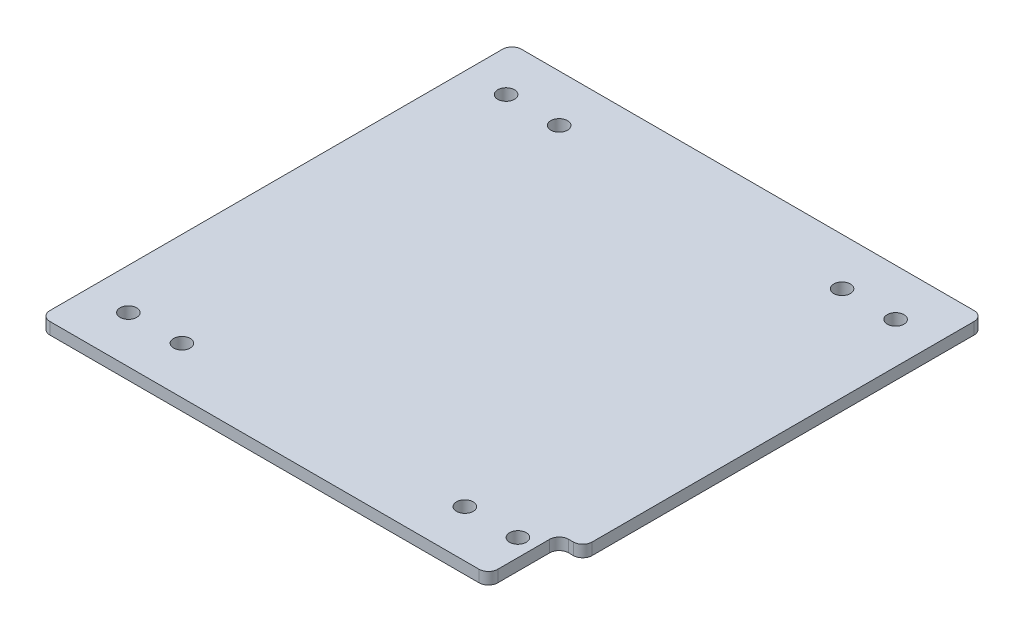
from build123d import *

# Parameters (mm, degrees)
SKETCH1_W                   = 127
SKETCH1_H                   = 127
BOSS_EXTRUDE1_DEPTH         = 3.175
F_16_0_177_DIAMETER_HOLE1_D = 4.4958
F_16_0_177_DIAMETER_HOLE2_D = 4.4958
SKETCH12_W                  = 6.35
SKETCH12_H                  = 19.05
CUT_EXTRUDE1_DEPTH          = 131.218638569
FILLET1_R                   = 2.54


with BuildPart() as part:
    # Sketch1 → Boss-Extrude1 (new body)
    with BuildSketch(Plane(origin=(0, 0, 0), x_dir=(1, 0, 0), z_dir=(0, 1, 0))):
        with Locations((-41.826357018, 13.006024096)):
            Rectangle(SKETCH1_W, SKETCH1_H)
    extrude(amount=BOSS_EXTRUDE1_DEPTH)

    # #16 (0.177) Diameter Hole1 (through all)
    with Locations(Plane(origin=(0, 0, 0), x_dir=(-1, 0, 0), z_dir=(0, -1, 0))):
        with Locations((3.726357018, 63.806024096), (79.926357018, -37.793975904), (79.926357018, 63.806024096), (3.726357018, -37.793975904)):
            Hole(F_16_0_177_DIAMETER_HOLE1_D / 2)

    # #16 (0.177) Diameter Hole2 (through all)
    with Locations(Plane(origin=(0, 0, 0), x_dir=(-1, 0, 0), z_dir=(0, -1, 0))):
        with Locations((-10.624642982, 63.869524096), (94.277357018, -37.857475904), (94.277357018, 63.869524096), (-10.624642982, -37.857475904)):
            Hole(F_16_0_177_DIAMETER_HOLE2_D / 2)

    # Sketch12 → Cut-Extrude1 (cut, through all)
    with BuildSketch(Plane(origin=(0, 3.175, 0), x_dir=(1, 0, 0), z_dir=(0, 1, 0))):
        with Locations((18.498642982, -40.968975904)):
            Rectangle(SKETCH12_W, SKETCH12_H)
    extrude(amount=-CUT_EXTRUDE1_DEPTH, mode=Mode.SUBTRACT)

    # Fillet1
    fillet1_edges = [part.edges().sort_by_distance(p)[0] for p in [
        (15.323642982, 1.5875, 50.493975904),
        (15.323642982, 1.5875, 31.443975904),
        (21.673642982, 1.5875, 31.443975904),
        (-105.326357018, 1.5875, 50.493975904),
        (-105.326357018, 1.5875, -76.506024096),
        (21.673642982, 1.5875, -76.506024096),
    ]]
    fillet(fillet1_edges, radius=FILLET1_R)


solid = part.part
